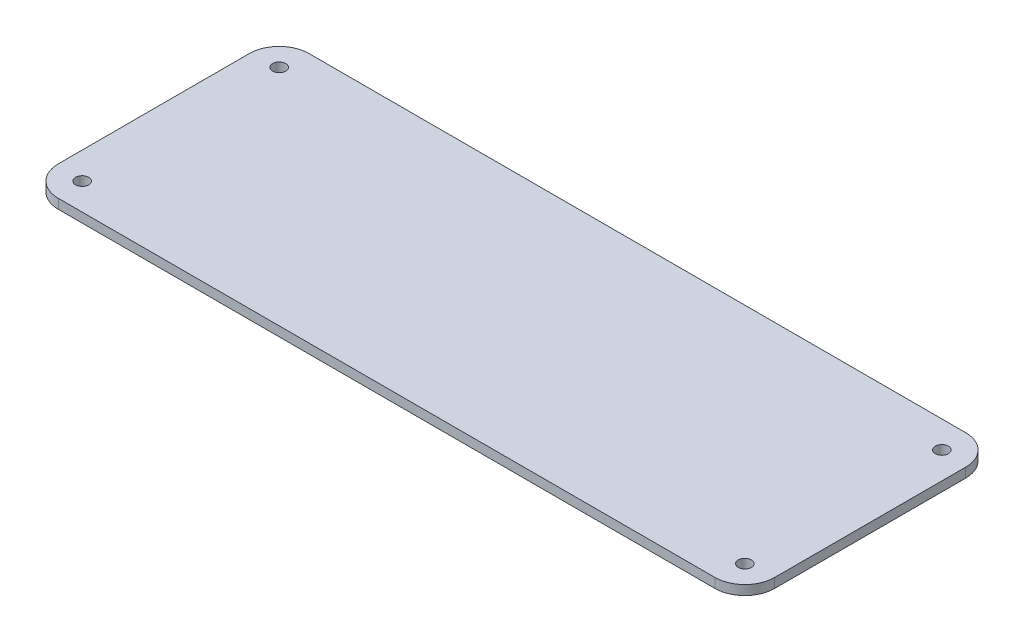
from build123d import *

# Parameters (mm, degrees)
AUFSATZ_LINEAR_AUSTRAGEN1_DEPTH = 1.6
SKIZZE2_R                       = 1.1
SCHNITT_LINEAR_AUSTRAGEN1_DEPTH = 64.588992758


with BuildPart() as part:
    # Skizze1 → Aufsatz-Linear austragen1 (new body)
    with BuildSketch(Plane(origin=(0, 0, 0), x_dir=(1, 0, 0), z_dir=(0, 1, 0))):
        with BuildLine():
            Line((-55, 21), (55, 21))
            ThreePointArc((55, 21), (58.535533906, 19.535533906), (60, 16))
            Line((60, 16), (60, -16))
            ThreePointArc((60, -16), (58.535533906, -19.535533906), (55, -21))
            Line((55, -21), (-55, -21))
            ThreePointArc((-55, -21), (-58.535533906, -19.535533906), (-60, -16))
            Line((-60, -16), (-60, 16))
            ThreePointArc((-60, 16), (-58.535533906, 19.535533906), (-55, 21))
        make_face()
    extrude(amount=AUFSATZ_LINEAR_AUSTRAGEN1_DEPTH)

    # Skizze2 → Schnitt-Linear austragen1 (cut, through all)
    with BuildSketch(Plane(origin=(0, 1.6, 0), x_dir=(1, 0, 0), z_dir=(0, 1, 0))):
        with Locations(Location((-55.5, 16.5, 0), (0, 0, 270))):
            Circle(SKIZZE2_R)
        with Locations(Location((-55.5, -16.5, 0), (0, 0, 270))):
            Circle(SKIZZE2_R)
        with Locations(Location((55.5, 16.5, 0), (0, 0, 270))):
            Circle(SKIZZE2_R)
        with Locations(Location((55.5, -16.5, 0), (0, 0, 270))):
            Circle(SKIZZE2_R)
    extrude(amount=-SCHNITT_LINEAR_AUSTRAGEN1_DEPTH, mode=Mode.SUBTRACT)


solid = part.part
